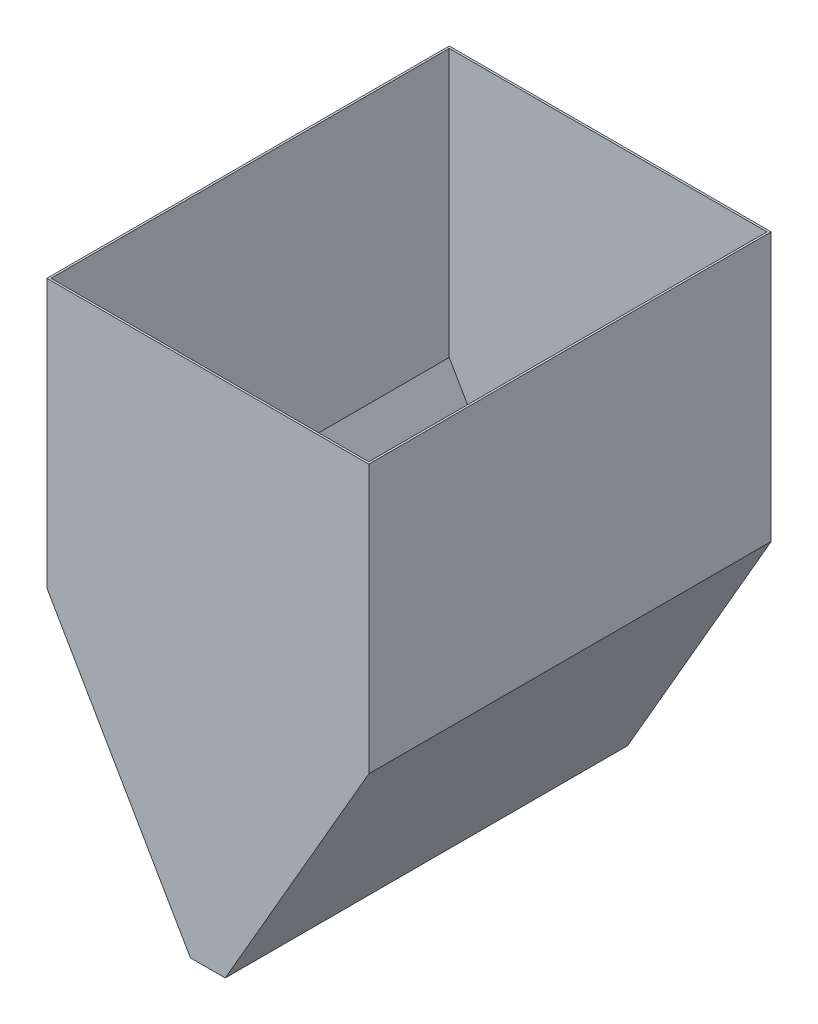
from build123d import *

# Parameters (mm, degrees)
CROQUIS3_W              = 120
CROQUIS3_H              = 150
SALIENTE_EXTRUIR1_DEPTH = 100
VACIADO2_T              = -0.76


with BuildPart() as part:
    # Croquis1 → Recubrir1 section 0
    with BuildSketch(Plane(origin=(0, 0, 0), x_dir=(1, 0, 0), z_dir=(0, 1, 0))):
        with BuildLine():
            Line((-60, 75), (60, 75))
            Line((60, 75), (60, -75))
            Line((60, -75), (-60, -75))
            Line((-60, -75), (-60, 75))
        make_face()
    # Croquis2 → Recubrir1 section 1
    with BuildSketch(Plane(origin=(0, -92.664, 0), x_dir=(1, 0, 0), z_dir=(0, 1, 0))):
        with BuildLine():
            Line((-6.5, 75), (6.5, 75))
            Line((6.5, 75), (6.5, -75))
            Line((6.5, -75), (-6.5, -75))
            Line((-6.5, -75), (-6.5, 75))
        make_face()
    loft()

    # Croquis3 → Saliente-Extruir1 (add)
    with BuildSketch(Plane(origin=(0, 0, 0), x_dir=(1, 0, 0), z_dir=(0, 1, 0))):
        Rectangle(CROQUIS3_W, CROQUIS3_H)
    extrude(amount=SALIENTE_EXTRUIR1_DEPTH)

    # Vaciado2
    vaciado2_openings = [part.faces().sort_by_distance(p)[0] for p in [
        (0, -92.664, 0),
        (0, 100, 0),
    ]]
    offset(amount=VACIADO2_T, openings=vaciado2_openings, kind=Kind.INTERSECTION)


solid = part.part
